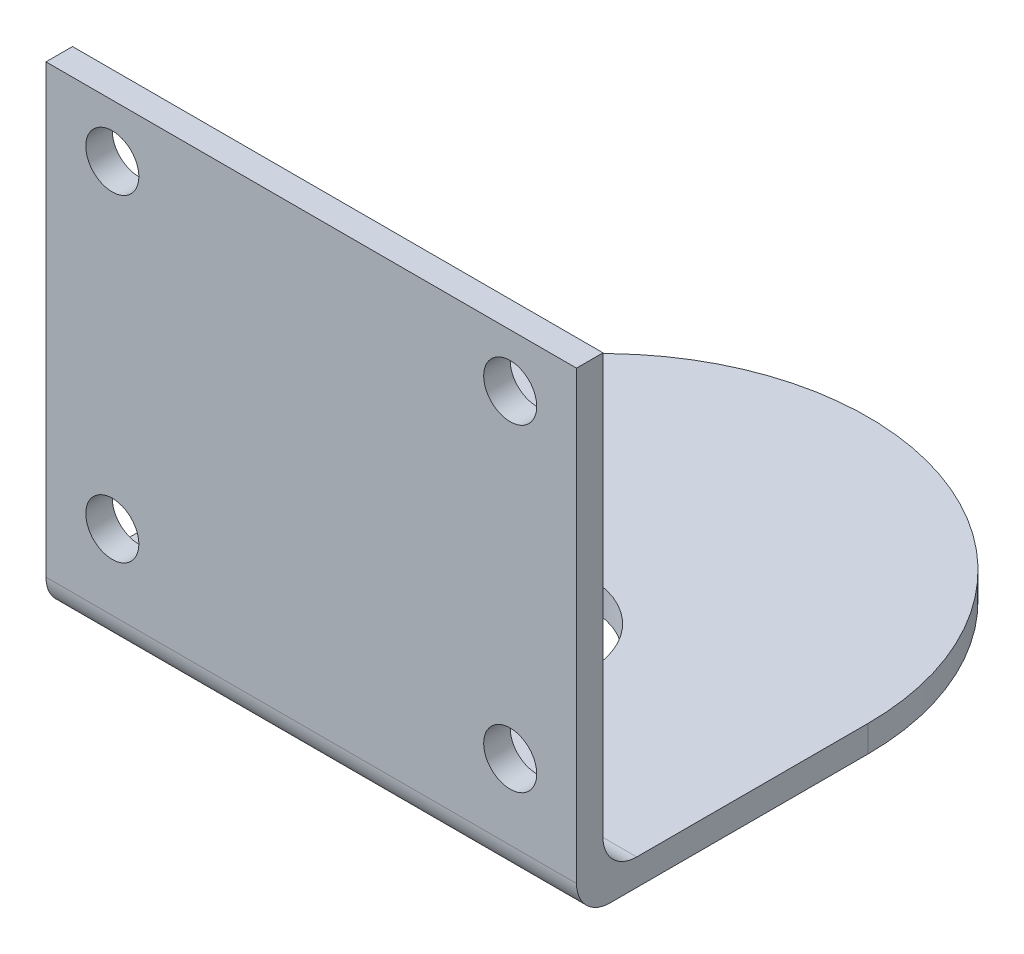
from build123d import *

# Parameters (mm, degrees)
SKETCH1_W               = 40.005
SKETCH1_H               = 36.195
BOSS_EXTRUDE1_DEPTH     = 2
BOSS_EXTRUDE3_DEPTH     = 2
FILLET1_R               = 2.54
SKETCH4_R               = 2
CUT_EXTRUDE1_DEPTH      = 49.245409238
CUT_EXTRUDE2_DEPTH      = 58.534146654
CUT_EXTRUDE2_DEPTH_BACK = 58.534146654
SKETCH5_R               = 6


with BuildPart() as part:
    # Sketch1 → Boss-Extrude1 (new body)
    with BuildSketch(Plane.XY):
        Rectangle(SKETCH1_W, SKETCH1_H)
    extrude(amount=BOSS_EXTRUDE1_DEPTH)

    # Sketch3 → Boss-Extrude3 (add)
    with BuildSketch(Plane.XZ.offset(18.0975)):
        with BuildLine():
            Line((20.0025, 0), (-20.0025, 0))
            Line((-20.0025, 0), (-20.0025, -19.9975))
            ThreePointArc((-20.0025, -19.9975), (0, -40), (20.0025, -19.9975))
            Line((20.0025, -19.9975), (20.0025, 0))
        make_face()
    extrude(amount=-BOSS_EXTRUDE3_DEPTH)

    # Fillet1
    fillet1_edges = [part.edges().sort_by_distance(p)[0] for p in [
        (0, -16.0975, 0),
        (0, -18.0975, 2),
    ]]
    fillet(fillet1_edges, radius=FILLET1_R)

    # Sketch4 → Cut-Extrude1 (cut, through all)
    with BuildSketch(Plane(origin=(0, 0, 0), x_dir=(-1, 0, 0), z_dir=(0, 0, -1))):
        with Locations((-15.0025, 14.0975)):
            Circle(SKETCH4_R)
        with Locations((15.0025, 14.0975)):
            Circle(SKETCH4_R)
        with Locations((15.0025, -9.9025)):
            Circle(SKETCH4_R)
        with Locations((-15.0025, -9.9025)):
            Circle(SKETCH4_R)
    extrude(amount=-CUT_EXTRUDE1_DEPTH, mode=Mode.SUBTRACT)

    # Sketch5 → Cut-Extrude2 (cut, two sides: drawn at the far end of the back side and taken through both)
    with BuildSketch(Plane.XZ.offset(18.0975).offset(-CUT_EXTRUDE2_DEPTH_BACK)):
        with Locations(Location((0, -13, 0), (0, 0, 270))):
            Circle(SKETCH5_R)
    extrude(amount=CUT_EXTRUDE2_DEPTH + CUT_EXTRUDE2_DEPTH_BACK, mode=Mode.SUBTRACT)


solid = part.part
